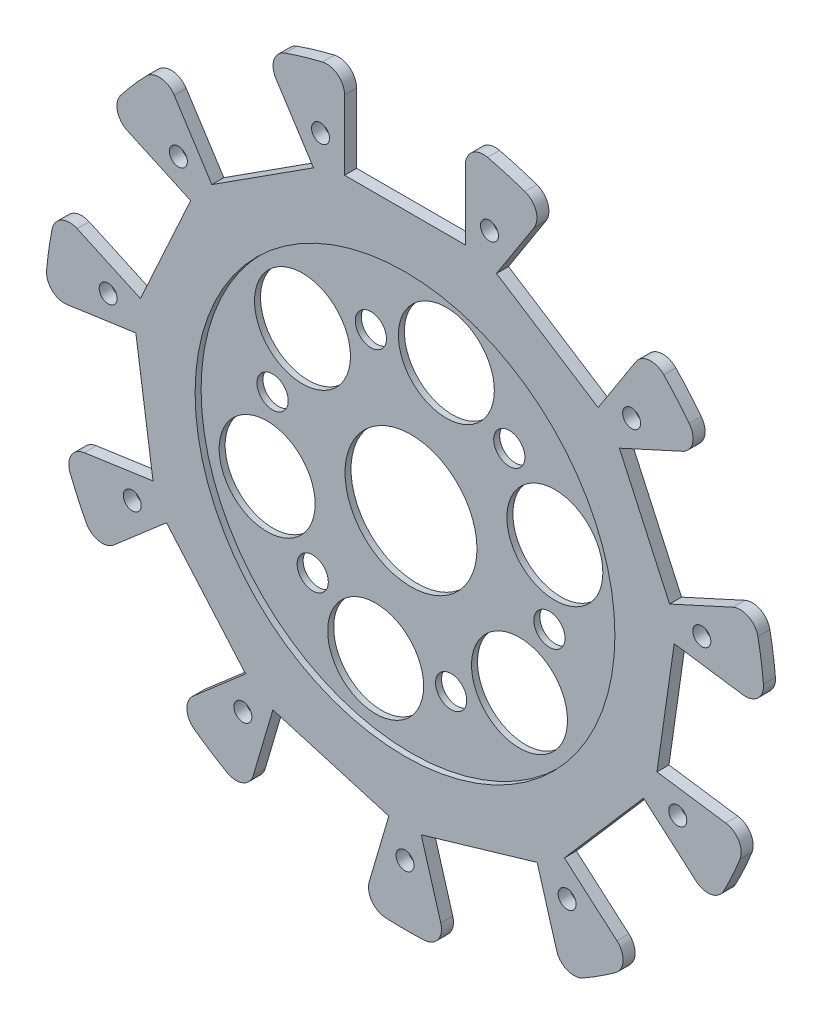
from build123d import *

# Parameters (mm, degrees)
BOSS_EXTRUDE1_DEPTH = 2
SKETCH2_R           = 35
CUT_EXTRUDE1_DEPTH  = 1
SKETCH4_R           = 1.5
CUT_EXTRUDE3_DEPTH  = 2
SKETCH5_R           = 2.6
SKETCH5_R_2         = 8
SKETCH5_R_3         = 11
CUT_EXTRUDE4_DEPTH  = 10


with BuildPart() as part:
    # Sketch1 → Boss-Extrude1 (new body)
    with BuildSketch(Plane.XY):
        with BuildLine():
            Line((21.520746486, 52.119258472), (15.256667967, 42.372162038))
            Line((15.256667967, 42.372162038), (32.20522538, 31.479985569))
            Line((32.20522538, 31.479985569), (38.4693039, 41.227082003))
            ThreePointArc((38.4693039, 41.227082003), (40.698070229, 42.590620718), (43.150594208, 41.689641633))
            ThreePointArc((43.150594208, 41.689641633), (45.344974461, 39.291644037), (47.406271028, 36.778328771))
            ThreePointArc((47.406271028, 36.778328771), (47.949048893, 34.222545257), (46.282202516, 32.210516346))
            Line((46.282202516, 32.210516346), (35.742846148, 27.397353567))
            Line((35.742846148, 27.397353567), (44.112124759, 9.071189697))
            Line((44.112124759, 9.071189697), (54.651481127, 13.884352476))
            ThreePointArc((54.651481127, 13.884352476), (57.263623361, 13.826472187), (58.839711753, 11.742585779))
            ThreePointArc((58.839711753, 11.742585779), (59.389286513, 8.538890296), (59.764558712, 5.310133889))
            ThreePointArc((59.764558712, 5.310133889), (58.83941162, 2.86662411), (56.349386262, 2.075162869))
            Line((56.349386262, 2.075162869), (44.880923224, 3.724078919))
            Line((44.880923224, 3.724078919), (42.013736207, -16.217644809))
            Line((42.013736207, -16.217644809), (53.482199245, -17.86656086))
            ThreePointArc((53.482199245, -17.86656086), (55.648380681, -19.32748357), (55.847636558, -21.93265809))
            ThreePointArc((55.847636558, -21.93265809), (54.577919721, -24.92490078), (53.148021281, -27.843990983))
            ThreePointArc((53.148021281, -27.843990983), (51.048676897, -29.399429937), (48.526038015, -28.719040157))
            Line((48.526038015, -28.719040157), (39.76962429, -21.131564473))
            Line((39.76962429, -21.131564473), (26.576283265, -36.357491677))
            Line((26.576283265, -36.357491677), (35.33269699, -43.944967362))
            ThreePointArc((35.33269699, -43.944967362), (36.365170327, -46.345099856), (35.124331356, -48.644437984))
            ThreePointArc((35.124331356, -48.644437984), (32.438449047, -50.47521197), (29.657362619, -52.157845455))
            ThreePointArc((29.657362619, -52.157845455), (27.050347952, -52.331372705), (25.296015568, -50.395150852))
            Line((25.296015568, -50.395150852), (22.031750643, -39.278085453))
            Line((22.031750643, -39.278085453), (2.701048165, -44.954091828))
            Line((2.701048165, -44.954091828), (5.96531309, -56.071157227))
            ThreePointArc((5.96531309, -56.071157227), (5.536275339, -58.648474396), (3.249299125, -59.911952524))
            ThreePointArc((3.249299125, -59.911952524), (0, -60), (-3.249299125, -59.911952524))
            ThreePointArc((-3.249299125, -59.911952524), (-5.536275339, -58.648474396), (-5.96531309, -56.071157227))
            Line((-5.96531309, -56.071157227), (-2.701048165, -44.954091828))
            Line((-2.701048165, -44.954091828), (-22.031750643, -39.278085453))
            Line((-22.031750643, -39.278085453), (-25.296015568, -50.395150852))
            ThreePointArc((-25.296015568, -50.395150852), (-27.050347952, -52.331372705), (-29.657362619, -52.157845455))
            ThreePointArc((-29.657362619, -52.157845455), (-32.438449047, -50.47521197), (-35.124331356, -48.644437984))
            ThreePointArc((-35.124331356, -48.644437984), (-36.365170327, -46.345099856), (-35.33269699, -43.944967362))
            Line((-35.33269699, -43.944967362), (-26.576283265, -36.357491677))
            Line((-26.576283265, -36.357491677), (-39.76962429, -21.131564473))
            Line((-39.76962429, -21.131564473), (-48.526038015, -28.719040157))
            ThreePointArc((-48.526038015, -28.719040157), (-51.048676897, -29.399429937), (-53.148021281, -27.843990983))
            ThreePointArc((-53.148021281, -27.843990983), (-54.577919721, -24.92490078), (-55.847636558, -21.93265809))
            ThreePointArc((-55.847636558, -21.93265809), (-55.648380681, -19.32748357), (-53.482199245, -17.86656086))
            Line((-53.482199245, -17.86656086), (-42.013736207, -16.217644809))
            Line((-42.013736207, -16.217644809), (-44.880923224, 3.724078919))
            Line((-44.880923224, 3.724078919), (-56.349386262, 2.075162869))
            ThreePointArc((-56.349386262, 2.075162869), (-58.83941162, 2.86662411), (-59.764558712, 5.310133889))
            ThreePointArc((-59.764558712, 5.310133889), (-59.389286513, 8.538890296), (-58.839711753, 11.742585779))
            ThreePointArc((-58.839711753, 11.742585779), (-57.263623361, 13.826472187), (-54.651481127, 13.884352476))
            Line((-54.651481127, 13.884352476), (-44.112124759, 9.071189697))
            Line((-44.112124759, 9.071189697), (-35.742846148, 27.397353567))
            Line((-35.742846148, 27.397353567), (-46.282202516, 32.210516346))
            ThreePointArc((-46.282202516, 32.210516346), (-47.949048893, 34.222545257), (-47.406271028, 36.778328771))
            ThreePointArc((-47.406271028, 36.778328771), (-45.344974461, 39.291644037), (-43.150594208, 41.689641633))
            ThreePointArc((-43.150594208, 41.689641633), (-40.698070229, 42.590620718), (-38.4693039, 41.227082003))
            Line((-38.4693039, 41.227082003), (-32.20522538, 31.479985569))
            Line((-32.20522538, 31.479985569), (-15.256667967, 42.372162038))
            Line((-15.256667967, 42.372162038), (-21.520746486, 52.119258472))
            ThreePointArc((-21.520746486, 52.119258472), (-21.835201934, 54.713050089), (-19.99682725, 56.569664131))
            ThreePointArc((-19.99682725, 56.569664131), (-16.90395341, 57.569578417), (-13.76146789, 58.400530832))
            ThreePointArc((-13.76146789, 58.400530832), (-11.211167359, 57.832548102), (-10.073394495, 55.480504291))
            Line((-10.073394495, 55.480504291), (-10.073394495, 43.894108449))
            Line((-10.073394495, 43.894108449), (10.073394495, 43.894108449))
            Line((10.073394495, 43.894108449), (10.073394495, 55.480504291))
            ThreePointArc((10.073394495, 55.480504291), (11.211167359, 57.832548102), (13.76146789, 58.400530832))
            ThreePointArc((13.76146789, 58.400530832), (16.90395341, 57.569578417), (19.99682725, 56.569664131))
            ThreePointArc((19.99682725, 56.569664131), (21.835201934, 54.713050089), (21.520746486, 52.119258472))
        make_face()
    extrude(amount=BOSS_EXTRUDE1_DEPTH)

    # Sketch2 → Cut-Extrude1 (cut)
    with BuildSketch(Plane.XY.offset(2)):
        Circle(SKETCH2_R)
    extrude(amount=-CUT_EXTRUDE1_DEPTH, mode=Mode.SUBTRACT)

    # Sketch4 → Cut-Extrude3 (cut)
    with BuildSketch(Plane.XY.offset(2)):
        with Locations((-14.086627842, 47.974648681)):
            Circle(SKETCH4_R)
        with Locations((14.086627842, 47.974648681)):
            Circle(SKETCH4_R)
        with Locations((37.787478718, 32.743036697)):
            Circle(SKETCH4_R)
        with Locations((49.491072094, 7.115741914)):
            Circle(SKETCH4_R)
        with Locations((45.481599768, -20.77075065)):
            Circle(SKETCH4_R)
        with Locations((27.032040873, -42.062676642)):
            Circle(SKETCH4_R)
        with Locations((0, -50)):
            Circle(SKETCH4_R)
        with Locations((-27.032040873, -42.062676642)):
            Circle(SKETCH4_R)
        with Locations((-45.481599768, -20.77075065)):
            Circle(SKETCH4_R)
        with Locations((-49.491072094, 7.115741914)):
            Circle(SKETCH4_R)
        with Locations((-37.787478718, 32.743036697)):
            Circle(SKETCH4_R)
    extrude(amount=-CUT_EXTRUDE3_DEPTH, mode=Mode.SUBTRACT)

    # Sketch5 → Cut-Extrude4 (cut)
    with BuildSketch(Plane.XY.offset(1)):
        with Locations((-6.691148225, 22.787958123)):
            Circle(SKETCH5_R)
        with Locations((-18.093350953, 17.251975287)):
            Circle(SKETCH5_R_2)
        Circle(SKETCH5_R_3)
        with Locations((16.389376523, 17.188683405)):
            Circle(SKETCH5_R)
        with Locations((5.893973388, 24.295289208)):
            Circle(SKETCH5_R_2)
        with Locations((23.080524748, -5.599274718)):
            Circle(SKETCH5_R)
        with Locations((23.98732434, 7.043313921)):
            Circle(SKETCH5_R_2)
        with Locations((6.691148225, -22.787958123)):
            Circle(SKETCH5_R)
        with Locations((18.093350953, -17.251975287)):
            Circle(SKETCH5_R_2)
        with Locations((-16.389376523, -17.188683405)):
            Circle(SKETCH5_R)
        with Locations((-5.893973388, -24.295289208)):
            Circle(SKETCH5_R_2)
        with Locations((-23.080524748, 5.599274718)):
            Circle(SKETCH5_R)
        with Locations((-23.98732434, -7.043313921)):
            Circle(SKETCH5_R_2)
    extrude(amount=-CUT_EXTRUDE4_DEPTH, mode=Mode.SUBTRACT)


solid = part.part
